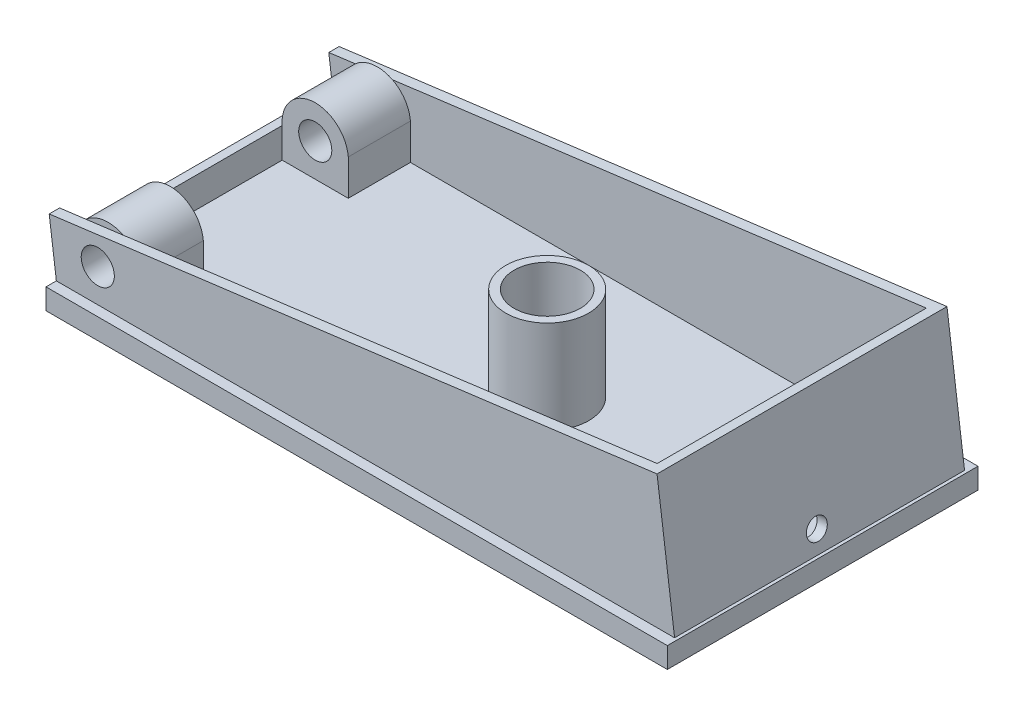
from build123d import *

# Parameters (mm, degrees)
SKETCH1_W               = 150
SKETCH1_H               = 75
BOSS_EXTRUDE1_DEPTH     = 2.5
BOSS_EXTRUDE5_START     = 32.5
BOSS_EXTRUDE5_DEPTH     = 2.5
BOSS_EXTRUDE2_START     = 17.5
SKETCH3_R               = 4
BOSS_EXTRUDE2_DEPTH     = 15
SKETCH2_R               = 10
SKETCH2_R_2             = 8
BOSS_EXTRUDE3_DEPTH     = 22.5
SKETCH5_W               = 2.026540741
SKETCH5_H               = 65
BOSS_EXTRUDE4_DEPTH     = 7.25
BOSS_EXTRUDE6_DEPTH     = 65
CUT_EXTRUDE1_DEPTH      = 112.106096906
CUT_EXTRUDE1_DEPTH_BACK = 112.106096906
SKETCH9_R               = 4
SKETCH13_R              = 2.5
CUT_EXTRUDE4_DEPTH      = 5


with BuildPart() as part:
    # Sketch1 → Boss-Extrude1 (new, symmetric)
    with BuildSketch(Plane(origin=(0, 0, 0), x_dir=(1, 0, 0), z_dir=(0, 1, 0))):
        Rectangle(SKETCH1_W, SKETCH1_H)
    extrude(amount=BOSS_EXTRUDE1_DEPTH, both=True)

    # Sketch7 → Boss-Extrude5 (add)
    with BuildSketch(Plane.XY.offset(BOSS_EXTRUDE5_START)):
        Polygon((70.01742626, 34.649589392), (74.25, 2.5), (-75, 2.5), (-76.731484571, 15.635393826), align=None)
    boss_extrude5 = extrude(amount=BOSS_EXTRUDE5_DEPTH)

    # Sketch3 → Boss-Extrude2 (add)
    with BuildSketch(Plane.XY.offset(BOSS_EXTRUDE2_START)):
        with BuildLine():
            Line((-72.973459259, 2.5), (-72.973459259, 11.15111247))
            ThreePointArc((-72.973459259, 11.15111247), (-65, 18.5), (-57.026540741, 11.15111247))
            Line((-57.026540741, 11.15111247), (-57.026540741, 2.5))
            Line((-57.026540741, 2.5), (-72.973459259, 2.5))
        make_face()
        with Locations(Location((-65, 10.5, 0), (0, 0, 180))):
            Circle(SKETCH3_R, mode=Mode.SUBTRACT)
    boss_extrude2 = extrude(amount=BOSS_EXTRUDE2_DEPTH)

    # Mirror1: Boss-Extrude5, Boss-Extrude2 across plane
    add(boss_extrude5.mirror(Plane.XY))
    add(boss_extrude2.mirror(Plane.XY))

    # Sketch2 → Boss-Extrude3 (add)
    with BuildSketch(Plane(origin=(0, 2.5, 0), x_dir=(1, 0, 0), z_dir=(0, 1, 0))):
        with Locations(Location((8.5, 0, 0), (0, 0, 90))):
            Circle(SKETCH2_R)
        with Locations(Location((8.5, 0, 0), (0, 0, 90))):
            Circle(SKETCH2_R_2, mode=Mode.SUBTRACT)
    extrude(amount=BOSS_EXTRUDE3_DEPTH)

    # Sketch5 → Boss-Extrude4 (add)
    with BuildSketch(Plane(origin=(0, 2.5, 0), x_dir=(1, 0, 0), z_dir=(0, 1, 0))):
        with Locations((-73.98672963, 0)):
            Rectangle(SKETCH5_W, SKETCH5_H)
    extrude(amount=BOSS_EXTRUDE4_DEPTH)

    # Sketch8 → Boss-Extrude6 (add)
    with BuildSketch(Plane.XY.offset(-32.5)):
        Polygon((70.01742626, 34.649589392), (74.25, 2.5), (71.728427599, 2.5), (67.53814582, 34.328350053), align=None)
    extrude(amount=BOSS_EXTRUDE6_DEPTH)

    # Sketch9 → Cut-Extrude1 (cut, two sides: drawn at the far end of the back side and taken through both)
    with BuildSketch(Plane.XY.offset(35).offset(-CUT_EXTRUDE1_DEPTH_BACK)):
        with Locations(Location((-65, 10.5, 0), (0, 0, 180))):
            Circle(SKETCH9_R)
    extrude(amount=CUT_EXTRUDE1_DEPTH + CUT_EXTRUDE1_DEPTH_BACK, mode=Mode.SUBTRACT)

    # Sketch13 → Cut-Extrude4 (cut)
    with BuildSketch(Plane(origin=(73.308520107, 9.651249767, 0), x_dir=(0, 0, -1), z_dir=(0.9914448613738098, 0.13052619222005604, 0))):
        with Locations(Location((0, -2.212957619, 0), (0, 0, 90))):
            Circle(SKETCH13_R)
    extrude(amount=-CUT_EXTRUDE4_DEPTH, mode=Mode.SUBTRACT)


solid = part.part
